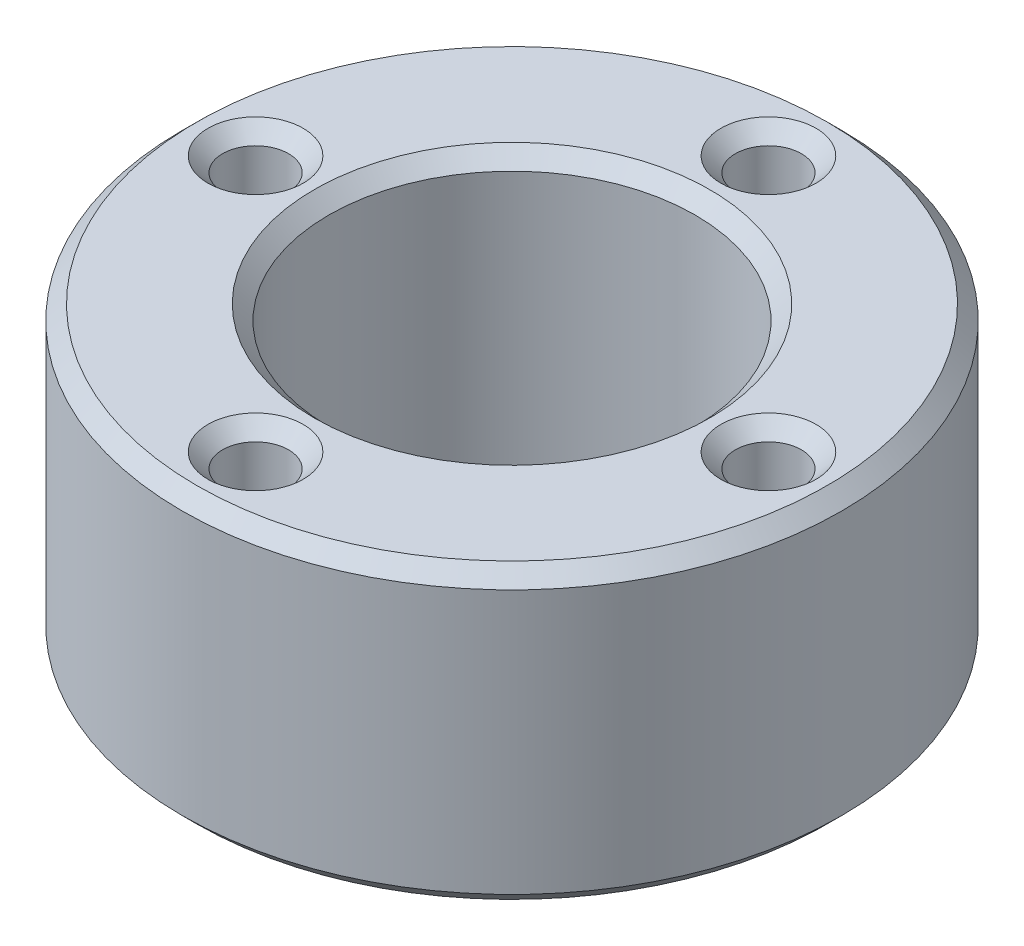
from build123d import *

# Parameters (mm, degrees)
SKETCH1_R           = 22.5
SKETCH1_R_2         = 2.25
SKETCH1_R_3         = 12.5
BOSS_EXTRUDE1_DEPTH = 20
CHAMFER1_SIZE       = 1


with BuildPart() as part:
    # Sketch1 → Boss-Extrude1 (new body)
    with BuildSketch(Plane(origin=(0, 0, 0), x_dir=(1, 0, 0), z_dir=(0, 1, 0))):
        with Locations(Location((0, 0, 0), (0, 0, 270))):
            Circle(SKETCH1_R)
        with Locations(Location((-17.5, 0, 0), (0, 0, 270))):
            Circle(SKETCH1_R_2, mode=Mode.SUBTRACT)
        with Locations(Location((0, 17.5, 0), (0, 0, 270))):
            Circle(SKETCH1_R_2, mode=Mode.SUBTRACT)
        with Locations(Location((17.5, 0, 0), (0, 0, 270))):
            Circle(SKETCH1_R_2, mode=Mode.SUBTRACT)
        with Locations(Location((0, -17.5, 0), (0, 0, 270))):
            Circle(SKETCH1_R_2, mode=Mode.SUBTRACT)
        with Locations(Location((0, 0, 0), (0, 0, 270))):
            Circle(SKETCH1_R_3, mode=Mode.SUBTRACT)
    extrude(amount=BOSS_EXTRUDE1_DEPTH)

    # Chamfer1
    chamfer1_edges = [part.edges().sort_by_distance(p)[0] for p in [
        (0, 0, -19.75),
        (0, 20, -19.75),
        (17.5, 0, -2.25),
        (17.5, 20, -2.25),
        (0, 0, -22.5),
        (0, 0, 15.25),
        (0, 20, 15.25),
        (0, 20, -22.5),
        (-17.5, 0, -2.25),
        (-17.5, 20, -2.25),
        (0, 0, -12.5),
        (0, 20, -12.5),
    ]]
    chamfer(chamfer1_edges, length=CHAMFER1_SIZE)


solid = part.part
